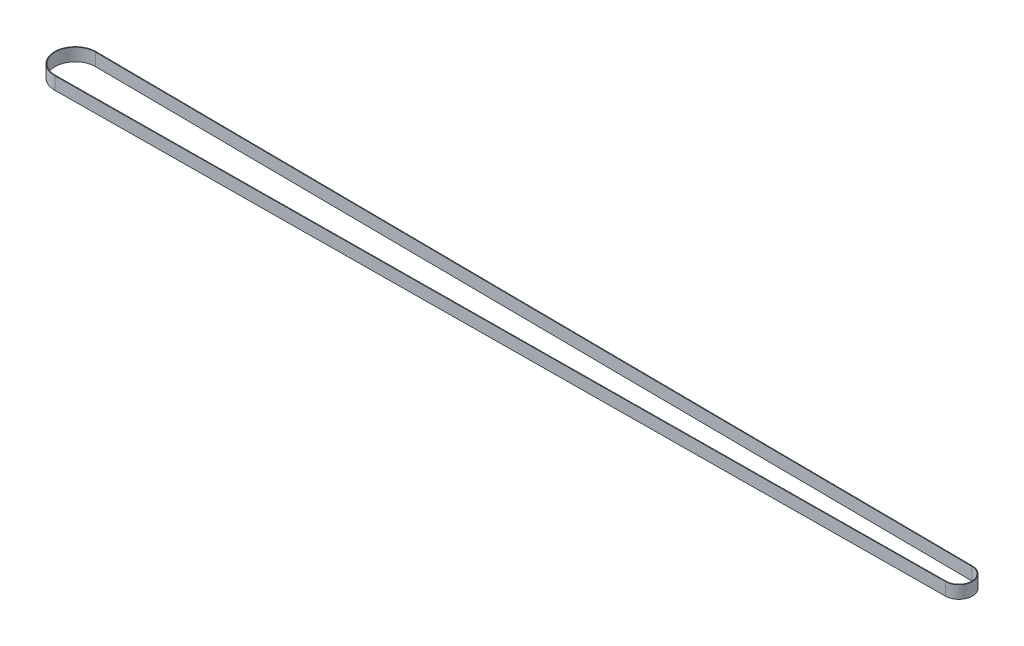
from build123d import *

# Parameters (mm, degrees)
BOSS_EXTRUDE1_DEPTH = 6


with BuildPart() as part:
    # Sketch1 → Boss-Extrude1 (new body)
    with BuildSketch(Plane(origin=(0, 0, 0), x_dir=(1, 0, 0), z_dir=(0, 1, 0))):
        with BuildLine():
            Line((-221.966745805, -9.838682672), (196.972245326, -6.411000017))
            ThreePointArc((196.972245326, -6.411000017), (203.383246809, -7.33e-07), (196.972246792, 6.411000017))
            Line((196.972246792, 6.411000017), (-221.966745805, 9.838682672))
            ThreePointArc((-221.966745805, 9.838682672), (-231.967753213, 0), (-221.966745805, -9.838682672))
        make_face()
        with BuildLine():
            Line((196.972246792, -6.096), (-221.971900005, -9.523724837))
            ThreePointArc((-221.971900005, -9.523724837), (-231.652753208, 7.33e-07), (-221.971898539, 9.523724813))
            Line((-221.971898539, 9.523724813), (196.972246792, 6.096))
            ThreePointArc((196.972246792, 6.096), (203.068246792, 0), (196.972246792, -6.096))
        make_face(mode=Mode.SUBTRACT)
    extrude(amount=BOSS_EXTRUDE1_DEPTH)


solid = part.part
